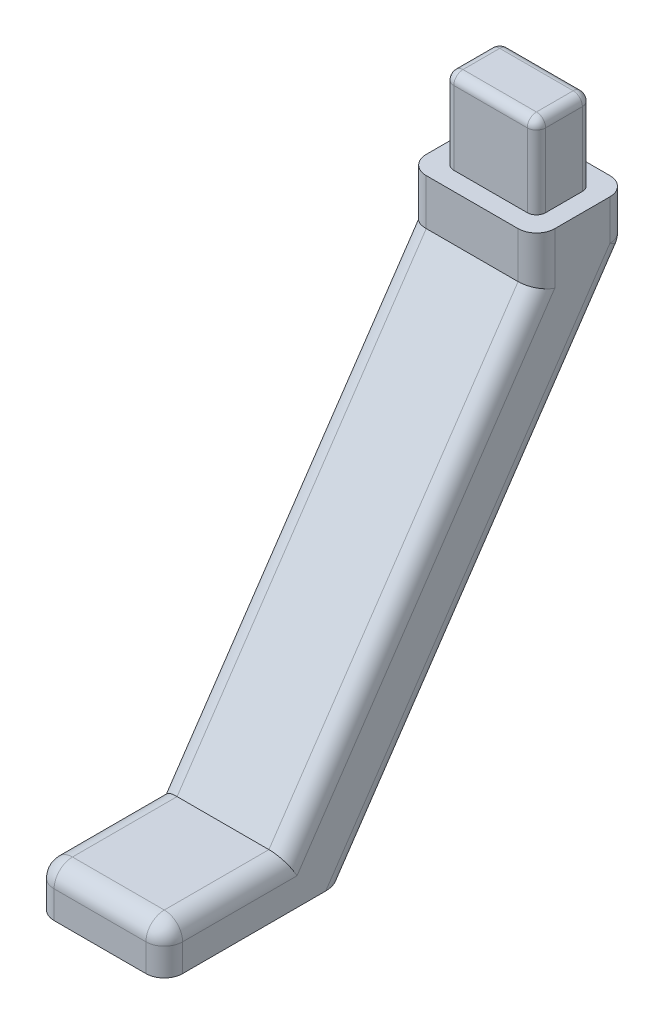
from build123d import *

# Parameters (mm, degrees)
SKETCH1_W           = 10
SKETCH1_H           = 6
BOSS_EXTRUDE1_DEPTH = 9
SKETCH2_W           = 14
SKETCH2_H           = 10
BOSS_EXTRUDE2_DEPTH = 5
BOSS_EXTRUDE3_DEPTH = 7
FILLET1_R           = 2
FILLET2_R           = 1


with BuildPart() as part:
    # Sketch1 → Boss-Extrude1 (new body)
    with BuildSketch(Plane(origin=(0, 0, 0), x_dir=(1, 0, 0), z_dir=(0, 1, 0))):
        Rectangle(SKETCH1_W, SKETCH1_H)
    extrude(amount=BOSS_EXTRUDE1_DEPTH)

    # Sketch2 → Boss-Extrude2 (add)
    with BuildSketch(Plane.XZ):
        Rectangle(SKETCH2_W, SKETCH2_H)
    extrude(amount=BOSS_EXTRUDE2_DEPTH)

    # Sketch4 → Boss-Extrude3 (add, symmetric)
    with BuildSketch(Plane(origin=(0, 0, 0), x_dir=(0, 0, -1), z_dir=(1, 0, 0))):
        Polygon((-5, -5), (-32.135462652, -45), (-45.527395483, -45), (-45.527395483, -50), (-25.527395483, -50), (5, -5), align=None)
    extrude(amount=BOSS_EXTRUDE3_DEPTH, both=True)

    # Fillet1
    fillet1_edges = [part.edges().sort_by_distance(p)[0] for p in [
        (7, -2.5, -5),
        (7, -2.5, 5),
        (-7, -2.5, 5),
        (-7, -2.5, -5),
        (0, -5, -5),
        (-7, -25, 18.567731326),
        (-7, -45, 38.831429068),
        (-7, -47.5, 45.527395483),
        (0, -45, 45.527395483),
        (-7, -27.5, 10.263697742),
        (7, -25, 18.567731326),
        (7, -45, 38.831429068),
        (7, -47.5, 45.527395483),
        (7, -27.5, 10.263697742),
    ]]
    fillet(fillet1_edges, radius=FILLET1_R)

    # Fillet2
    fillet2_edges = [part.edges().sort_by_distance(p)[0] for p in [
        (-5, 9, 0),
        (0, 9, 3),
        (5, 9, 0),
        (5, 4.5, 3),
        (-5, 4.5, 3),
        (-5, 4.5, -3),
        (5, 4.5, -3),
        (0, 9, -3),
    ]]
    fillet(fillet2_edges, radius=FILLET2_R)


solid = part.part
